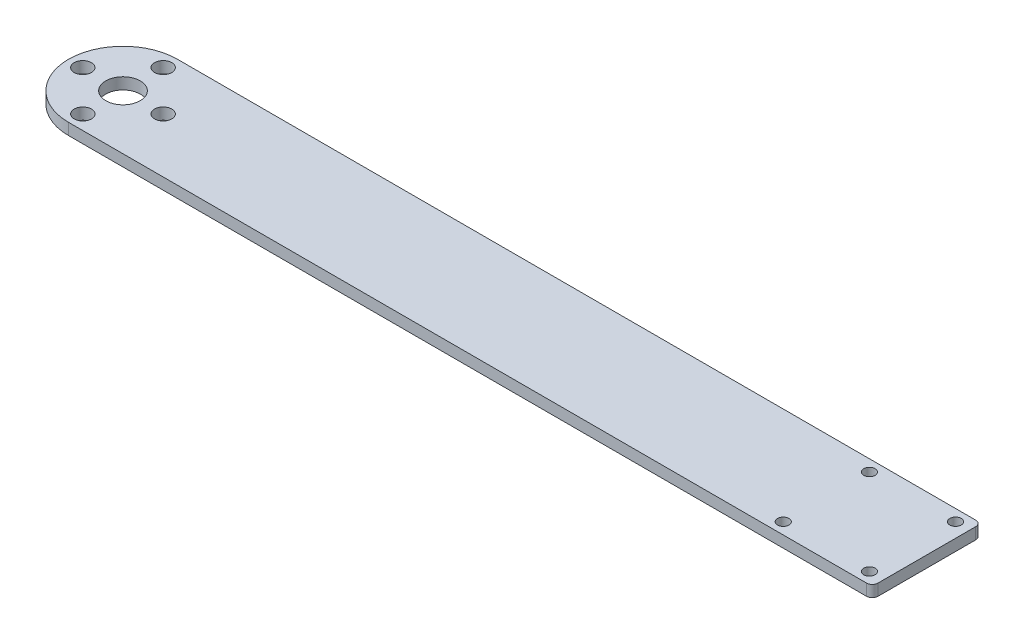
from build123d import *

# Parameters (mm, degrees)
SKETCH_1_R      = 1.5
SKETCH_1_R_2    = 1
SKETCH_1_R_3    = 3
EXTRUDE_1_DEPTH = 2
FILLET_1_R      = 1


with BuildPart() as part:
    # Эскиз1 → Бобышка-Вытянуть1 (new body)
    with BuildSketch(Plane(origin=(0, 0, 0), x_dir=(1, 0, 0), z_dir=(0, 1, 0))):
        with BuildLine():
            Line((0, 9.5), (140, 9.5))
            Line((140, 9.5), (140, -9.5))
            Line((140, -9.5), (0, -9.5))
            ThreePointArc((0, -9.5), (-9.5, 0), (0, 9.5))
        make_face()
        with Locations(Location((0, 7, 0), (0, 0, 270))):
            Circle(SKETCH_1_R, mode=Mode.SUBTRACT)
        with Locations(Location((7, 0, 0), (0, 0, 270))):
            Circle(SKETCH_1_R, mode=Mode.SUBTRACT)
        with Locations(Location((0, -7, 0), (0, 0, 270))):
            Circle(SKETCH_1_R, mode=Mode.SUBTRACT)
        with Locations(Location((-7, 0, 0), (0, 0, 270))):
            Circle(SKETCH_1_R, mode=Mode.SUBTRACT)
        with Locations(Location((122.5, 7.5, 0), (0, 0, 270))):
            Circle(SKETCH_1_R_2, mode=Mode.SUBTRACT)
        with Locations(Location((137.5, 7.5, 0), (0, 0, 270))):
            Circle(SKETCH_1_R_2, mode=Mode.SUBTRACT)
        with Locations(Location((122.5, -7.5, 0), (0, 0, 270))):
            Circle(SKETCH_1_R_2, mode=Mode.SUBTRACT)
        with Locations(Location((137.5, -7.5, 0), (0, 0, 270))):
            Circle(SKETCH_1_R_2, mode=Mode.SUBTRACT)
        with Locations(Location((0, 0, 0), (0, 0, 270))):
            Circle(SKETCH_1_R_3, mode=Mode.SUBTRACT)
    extrude(amount=EXTRUDE_1_DEPTH)

    # Скругление1
    fillet_1_edges = [part.edges().sort_by_distance(p)[0] for p in [
        (140, 1, -9.5),
        (140, 1, 9.5),
    ]]
    fillet(fillet_1_edges, radius=FILLET_1_R)


solid = part.part
